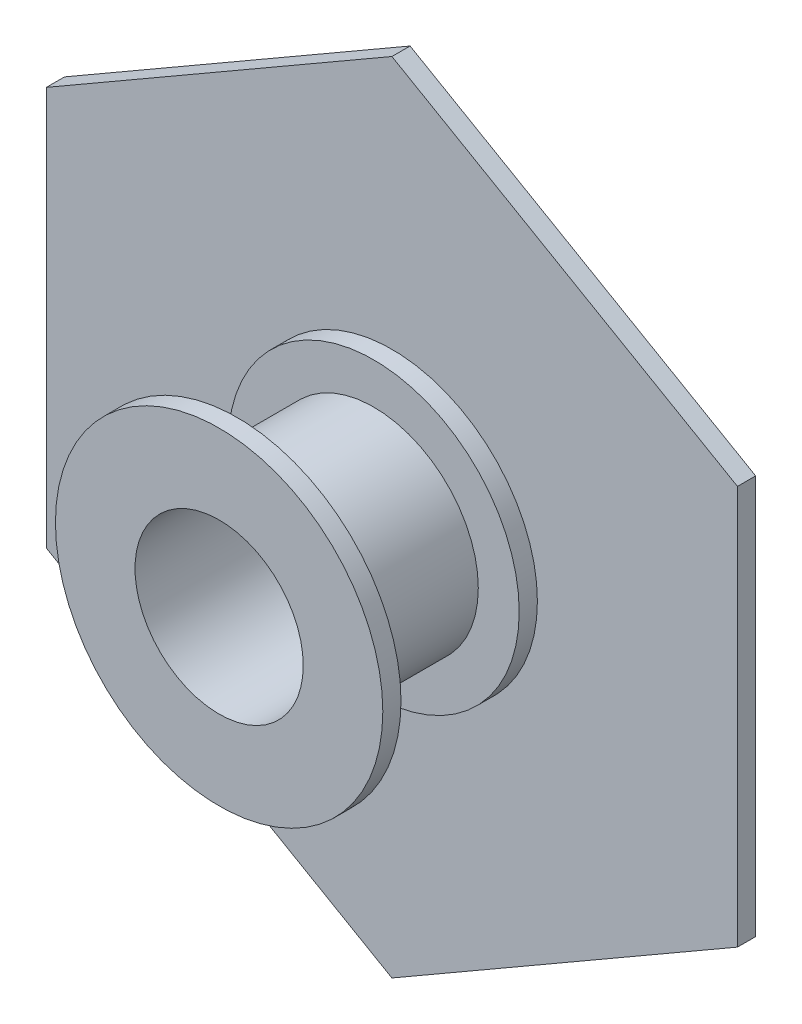
from build123d import *

# Parameters (mm, degrees)
HEX_BASE_DEPTH      = 6.35
SKETCH2_R           = 29.36875
ID_2_DEPTH          = 185.405282824
PIPE_START          = 53.975
SKETCH3_R           = 36.5125
SKETCH3_R_2         = 29.36875
PIPE_DEPTH          = 53.975
FLANGE_START        = 6.35
SKETCH4_R           = 57.15
SKETCH4_R_2         = 29.36875
FLANGE_DEPTH        = 6.35
REINFORCEMENT_START = 6.35
SKETCH5_R           = 50.8
SKETCH5_R_2         = 36.5125
REINFORCEMENT_DEPTH = 6.35


with BuildPart() as part:
    # Sketch1 → hex_base (new body)
    with BuildSketch(Plane.XY):
        Polygon((120.65, 69.657309978), (0, 139.314619955), (-120.65, 69.657309978), (-120.65, -69.657309978), (0, -139.314619955), (120.65, -69.657309978), align=None)
    extrude(amount=HEX_BASE_DEPTH)

    # Sketch2 → ID 2 (cut, through all)
    with BuildSketch(Plane.XY.offset(6.35)):
        Circle(SKETCH2_R)
    extrude(amount=-ID_2_DEPTH, mode=Mode.SUBTRACT)

    # Sketch3 → pipe (add)
    with BuildSketch(Plane.XY.offset(6.35).offset(PIPE_START)):
        Circle(SKETCH3_R)
        Circle(SKETCH3_R_2, mode=Mode.SUBTRACT)
    extrude(amount=-PIPE_DEPTH)

    # Sketch4 → flange (add)
    with BuildSketch(Plane.XY.offset(60.325).offset(FLANGE_START)):
        Circle(SKETCH4_R)
        Circle(SKETCH4_R_2, mode=Mode.SUBTRACT)
    extrude(amount=-FLANGE_DEPTH)

    # Sketch5 → reinforcement (add)
    with BuildSketch(Plane.XY.offset(6.35).offset(REINFORCEMENT_START)):
        Circle(SKETCH5_R)
        Circle(SKETCH5_R_2, mode=Mode.SUBTRACT)
    extrude(amount=-REINFORCEMENT_DEPTH)


solid = part.part
